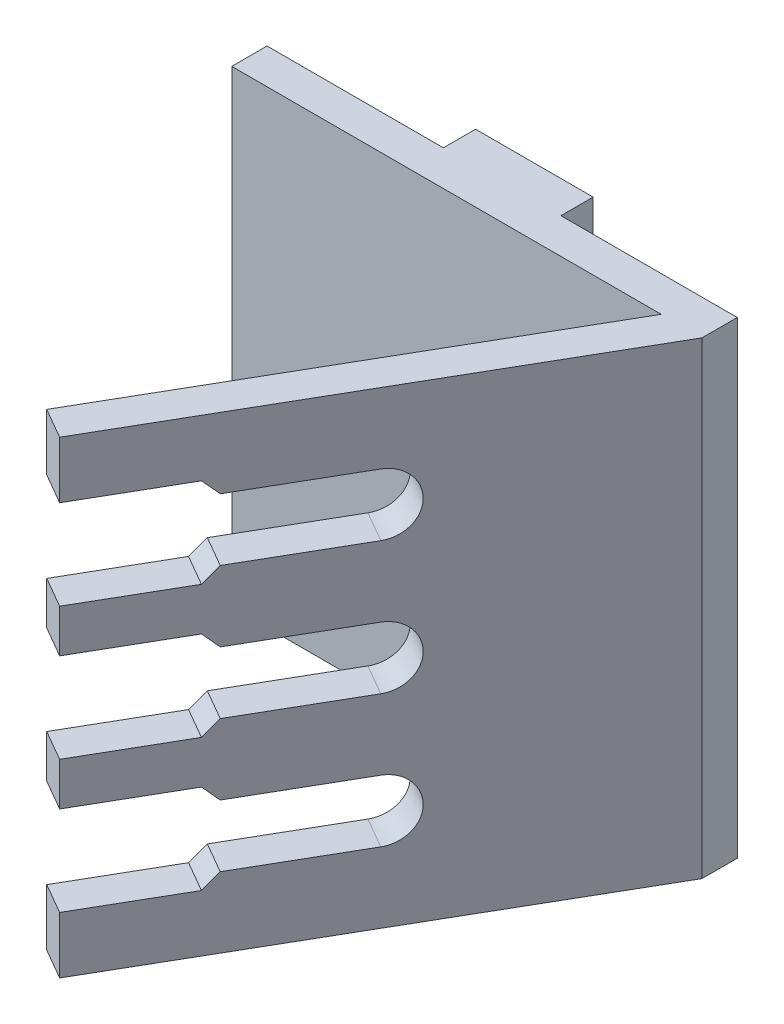
from build123d import *

# Parameters (mm, degrees)
BOSS_EXTRUDE1_DEPTH = 39.84
CUT_EXTRUDE1_REACH  = 62.108
SKETCH3_W           = 10
SKETCH3_H           = 2.74
BOSS_EXTRUDE2_DEPTH = 2.74


with BuildPart() as part:
    # Sketch1 → Boss-Extrude1 (new body)
    with BuildSketch(Plane(origin=(0, 0, 0), x_dir=(-1, 0, 0), z_dir=(0, 1, 0))):
        Polygon((-12.003904286, -2.835509232), (-12.003904286, -5.835509232), (27.996095714, -5.835509232), (27.996095714, -2.835509232), (-8.539802671, -2.835509232), (10.594171925, 30.305506919), (7.996095714, 31.805506919), align=None)
    extrude(amount=BOSS_EXTRUDE1_DEPTH)

    # Sketch2 → Cut-Extrude1 (cut, up to next)
    with BuildSketch(Plane(origin=(7.775116701, 0, 4.48896572), x_dir=(0, 1, 0), z_dir=(0.8660254037844364, 0, 0.5000000000000038)), mode=Mode.PRIVATE) as cut_extrude1_sk1:
        with BuildLine():
            Line((6, 21.542424829), (6, 11.542424829))
            ThreePointArc((6, 11.542424829), (8.64, 8.902424829), (11.28, 11.542424829))
            Line((11.28, 11.542424829), (11.28, 21.542424829))
            Line((11.28, 21.542424829), (12.45, 22.712424829))
            Line((12.45, 22.712424829), (12.45, 31.542424829))
            Line((12.45, 31.542424829), (11.28, 31.542424829))
            Line((11.28, 31.542424829), (6, 31.542424829))
            Line((6, 31.542424829), (4.83, 31.542424829))
            Line((4.83, 31.542424829), (4.83, 22.712424829))
            Line((4.83, 22.712424829), (6, 21.542424829))
        make_face()
    cut_extrude1_tool1 = extrude(cut_extrude1_sk1.sketch, amount=-CUT_EXTRUDE1_REACH, mode=Mode.PRIVATE) & part.part
    # Sketch2 → Cut-Extrude1 (cut, up to next)
    with BuildSketch(Plane(origin=(7.775116701, 0, 4.48896572), x_dir=(0, 1, 0), z_dir=(0.8660254037844364, 0, 0.5000000000000038)), mode=Mode.PRIVATE) as cut_extrude1_sk2:
        with BuildLine():
            Line((22.56, 21.542424829), (22.56, 11.542424829))
            ThreePointArc((22.56, 11.542424829), (19.92, 8.902424829), (17.28, 11.542424829))
            Line((17.28, 11.542424829), (17.28, 21.542424829))
            Line((17.28, 21.542424829), (16.11, 22.712424829))
            Line((16.11, 22.712424829), (16.11, 31.542424829))
            Line((16.11, 31.542424829), (17.28, 31.542424829))
            Line((17.28, 31.542424829), (22.56, 31.542424829))
            Line((22.56, 31.542424829), (23.73, 31.542424829))
            Line((23.73, 31.542424829), (23.73, 22.712424829))
            Line((23.73, 22.712424829), (22.56, 21.542424829))
        make_face()
    cut_extrude1_tool2 = extrude(cut_extrude1_sk2.sketch, amount=-CUT_EXTRUDE1_REACH, mode=Mode.PRIVATE) & part.part
    # Sketch2 → Cut-Extrude1 (cut, up to next)
    with BuildSketch(Plane(origin=(7.775116701, 0, 4.48896572), x_dir=(0, 1, 0), z_dir=(0.8660254037844364, 0, 0.5000000000000038)), mode=Mode.PRIVATE) as cut_extrude1_sk3:
        with BuildLine():
            Line((33.84, 21.542424829), (33.84, 11.542424829))
            ThreePointArc((33.84, 11.542424829), (31.2, 8.902424829), (28.56, 11.542424829))
            Line((28.56, 11.542424829), (28.56, 21.542424829))
            Line((28.56, 21.542424829), (27.39, 22.712424829))
            Line((27.39, 22.712424829), (27.39, 31.542424829))
            Line((27.39, 31.542424829), (28.56, 31.542424829))
            Line((28.56, 31.542424829), (33.84, 31.542424829))
            Line((33.84, 31.542424829), (35.01, 31.542424829))
            Line((35.01, 31.542424829), (35.01, 22.712424829))
            Line((35.01, 22.712424829), (33.84, 21.542424829))
        make_face()
    cut_extrude1_tool3 = extrude(cut_extrude1_sk3.sketch, amount=-CUT_EXTRUDE1_REACH, mode=Mode.PRIVATE) & part.part
    add(cut_extrude1_tool1.solids().sort_by_distance((-2.97705, 8.64, 23.112265))[0], mode=Mode.SUBTRACT)
    add(cut_extrude1_tool2.solids().sort_by_distance((-2.97705, 19.92, 23.112265))[0], mode=Mode.SUBTRACT)
    add(cut_extrude1_tool3.solids().sort_by_distance((-2.97705, 31.2, 23.112265))[0], mode=Mode.SUBTRACT)

    # Sketch3 → Boss-Extrude2 (add)
    with BuildSketch(Plane(origin=(0, 0, -5.835509232), x_dir=(1, 0, 0), z_dir=(0, 0, -1))):
        with Locations((-7.996095714, -1.37)):
            Rectangle(SKETCH3_W, SKETCH3_H)
        with Locations((-7.996095714, -38.47)):
            Rectangle(SKETCH3_W, SKETCH3_H)
    extrude(amount=BOSS_EXTRUDE2_DEPTH)


solid = part.part
